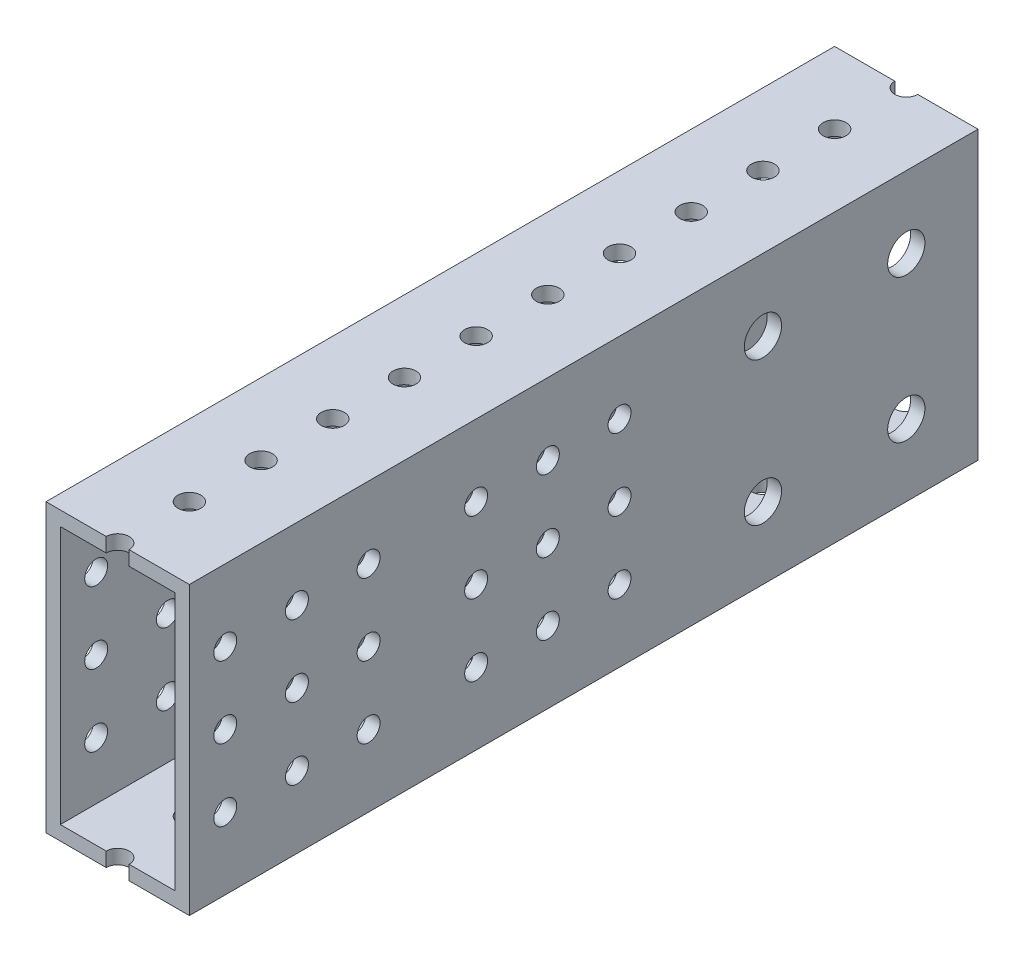
from build123d import *

# Parameters (mm, degrees)
SKETCH1_W               = 25.4
SKETCH1_H               = 50.8
SKETCH1_W_2             = 20.32
SKETCH1_H_2             = 45.72
BOSS_EXTRUDE1_DEPTH     = 114.3
SKETCH6_W               = 25.4
SKETCH6_H               = 50.8
SKETCH6_W_2             = 20.32
SKETCH6_H_2             = 45.72
BOSS_EXTRUDE4_DEPTH     = 38.1
SKETCH2_R               = 2.032
CUT_EXTRUDE1_DEPTH      = 162.144934764
CUT_EXTRUDE2_DEPTH      = 157.576115675
CUT_EXTRUDE2_DEPTH_BACK = 157.576115675
SKETCH3_R               = 2.032
SKETCH7_W               = 25.4
SKETCH7_H               = 50.8
CUT_EXTRUDE3_DEPTH      = 12.7
SKETCH8_R               = 3.302
CUT_EXTRUDE5_DEPTH      = 157.576115675
SKETCH9_R               = 2.032
CUT_EXTRUDE6_DEPTH      = 157.576115675


with BuildPart() as part:
    # Sketch1 → Boss-Extrude1 (new body)
    with BuildSketch(Plane.XY):
        Rectangle(SKETCH1_W, SKETCH1_H)
        Rectangle(SKETCH1_W_2, SKETCH1_H_2, mode=Mode.SUBTRACT)
    extrude(amount=BOSS_EXTRUDE1_DEPTH)

    # Sketch6 → Boss-Extrude4 (add)
    with BuildSketch(Plane.XY.offset(114.3)):
        Rectangle(SKETCH6_W, SKETCH6_H)
        Rectangle(SKETCH6_W_2, SKETCH6_H_2, mode=Mode.SUBTRACT)
    extrude(amount=BOSS_EXTRUDE4_DEPTH)

    # Sketch2 → Cut-Extrude1 (cut, through all)
    with BuildSketch(Plane(origin=(0, 25.4, 0), x_dir=(1, 0, 0), z_dir=(0, 1, 0))):
        Circle(SKETCH2_R)
        with Locations(Location((0, -12.7, 0), (0, 0, 270))):
            Circle(SKETCH2_R)
        with Locations(Location((0, -25.4, 0), (0, 0, 270))):
            Circle(SKETCH2_R)
        with Locations(Location((0, -38.1, 0), (0, 0, 270))):
            Circle(SKETCH2_R)
        with Locations(Location((0, -50.8, 0), (0, 0, 270))):
            Circle(SKETCH2_R)
        with Locations(Location((0, -63.5, 0), (0, 0, 270))):
            Circle(SKETCH2_R)
        with Locations(Location((0, -76.2, 0), (0, 0, 270))):
            Circle(SKETCH2_R)
        with Locations(Location((0, -88.9, 0), (0, 0, 270))):
            Circle(SKETCH2_R)
        with Locations(Location((0, -101.6, 0), (0, 0, 270))):
            Circle(SKETCH2_R)
        with Locations(Location((0, -114.3, 0), (0, 0, 270))):
            Circle(SKETCH2_R)
        with Locations(Location((0, -127, 0), (0, 0, 270))):
            Circle(SKETCH2_R)
        with Locations(Location((0, -139.7, 0), (0, 0, 270))):
            Circle(SKETCH2_R)
        with Locations((0, -152.4)):
            Circle(SKETCH2_R)
        with Locations((0, -165.1)):
            Circle(SKETCH2_R)
        with Locations((0, -177.8)):
            Circle(SKETCH2_R)
        with Locations((0, -190.5)):
            Circle(SKETCH2_R)
        with Locations((0, -203.2)):
            Circle(SKETCH2_R)
        with Locations((0, -215.9)):
            Circle(SKETCH2_R)
        with Locations((0, -228.6)):
            Circle(SKETCH2_R)
        with Locations((0, -241.3)):
            Circle(SKETCH2_R)
    extrude(amount=-CUT_EXTRUDE1_DEPTH, mode=Mode.SUBTRACT)

    # Sketch3 → Cut-Extrude2 (cut, two sides: drawn at the far end of the back side and taken through both)
    with BuildSketch(Plane.ZY.offset(12.7).offset(-CUT_EXTRUDE2_DEPTH_BACK)):
        with Locations((101.6, 12.7)):
            Circle(SKETCH3_R)
        with Locations((101.6, 0)):
            Circle(SKETCH3_R)
        with Locations((101.6, -12.7)):
            Circle(SKETCH3_R)
        with Locations((88.9, 0)):
            Circle(SKETCH3_R)
        with Locations((88.9, -12.7)):
            Circle(SKETCH3_R)
        with Locations((76.2, 0)):
            Circle(SKETCH3_R)
        with Locations((76.2, -12.7)):
            Circle(SKETCH3_R)
        with Locations((88.9, 12.7)):
            Circle(SKETCH3_R)
        with Locations((76.2, 12.7)):
            Circle(SKETCH3_R)
    extrude(amount=CUT_EXTRUDE2_DEPTH + CUT_EXTRUDE2_DEPTH_BACK, mode=Mode.SUBTRACT)

    # Sketch7 → Cut-Extrude3 (cut)
    with BuildSketch(Plane(origin=(0, 0, 0), x_dir=(-1, 0, 0), z_dir=(0, 0, -1))):
        Rectangle(SKETCH7_W, SKETCH7_H)
    extrude(amount=-CUT_EXTRUDE3_DEPTH, mode=Mode.SUBTRACT)

    # Sketch8 → Cut-Extrude5 (cut, through all)
    with BuildSketch(Plane.ZY.offset(12.7)):
        with Locations((25.4, 12.7)):
            Circle(SKETCH8_R)
        with Locations((25.4, -12.7)):
            Circle(SKETCH8_R)
        with Locations((50.8, -12.7)):
            Circle(SKETCH8_R)
        with Locations((50.8, 12.7)):
            Circle(SKETCH8_R)
    extrude(amount=-CUT_EXTRUDE5_DEPTH, mode=Mode.SUBTRACT)

    # Sketch9 → Cut-Extrude6 (cut, through all)
    with BuildSketch(Plane.ZY.offset(12.7)):
        with Locations((146.05, 12.7)):
            Circle(SKETCH9_R)
        with Locations((146.05, 0)):
            Circle(SKETCH9_R)
        with Locations((146.05, -12.7)):
            Circle(SKETCH9_R)
        with Locations((133.35, 0)):
            Circle(SKETCH9_R)
        with Locations((133.35, -12.7)):
            Circle(SKETCH9_R)
        with Locations((120.65, 0)):
            Circle(SKETCH9_R)
        with Locations((120.65, -12.7)):
            Circle(SKETCH9_R)
        with Locations((133.35, 12.7)):
            Circle(SKETCH9_R)
        with Locations((120.65, 12.7)):
            Circle(SKETCH9_R)
    extrude(amount=-CUT_EXTRUDE6_DEPTH, mode=Mode.SUBTRACT)


solid = part.part
